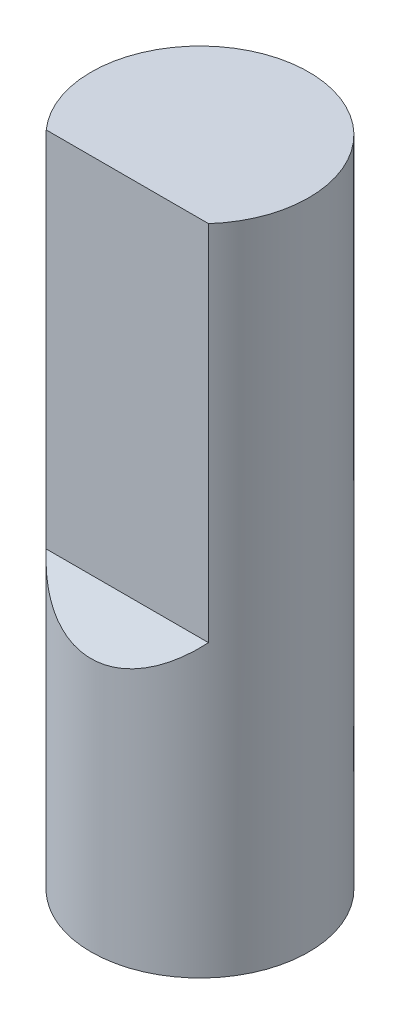
from build123d import *

# Parameters (mm, degrees)
SKETCH1_R               = 3
BOSS_EXTRUDE1_DEPTH     = 18
CUT_EXTRUDE1_START      = -10
CUT_EXTRUDE1_DEPTH      = 10
CUT_EXTRUDE2_DEPTH      = 19.493242009
CUT_EXTRUDE2_DEPTH_BACK = 19.493242009


with BuildPart() as part:
    # Sketch1 → Boss-Extrude1 (new body)
    with BuildSketch(Plane(origin=(0, 0, 0), x_dir=(1, 0, 0), z_dir=(0, 1, 0))):
        with Locations(Location((0, 0, 0), (0, 0, 270))):
            Circle(SKETCH1_R)
    extrude(amount=BOSS_EXTRUDE1_DEPTH)

    # Sketch2 → Cut-Extrude1 (cut)
    with BuildSketch(Plane(origin=(0, 18, 0), x_dir=(1, 0, 0), z_dir=(0, 1, 0)).offset(CUT_EXTRUDE1_START)):
        with BuildLine():
            Line((-2.236067977, -2), (2.236067977, -2))
            ThreePointArc((2.236067977, -2), (0, -3), (-2.236067977, -2))
        make_face()
    extrude(amount=CUT_EXTRUDE1_DEPTH, mode=Mode.SUBTRACT)

    # Sketch3 → Cut-Extrude2 (cut, two sides: drawn at the far end of the back side and taken through both)
    with BuildSketch(Plane(origin=(0, 0, 0), x_dir=(0, 0, -1), z_dir=(1, 0, 0)).offset(-CUT_EXTRUDE2_DEPTH_BACK)):
        Polygon((-2, 8), (-3, 7), (-3, 8), align=None)
    extrude(amount=CUT_EXTRUDE2_DEPTH + CUT_EXTRUDE2_DEPTH_BACK, mode=Mode.SUBTRACT)


solid = part.part
